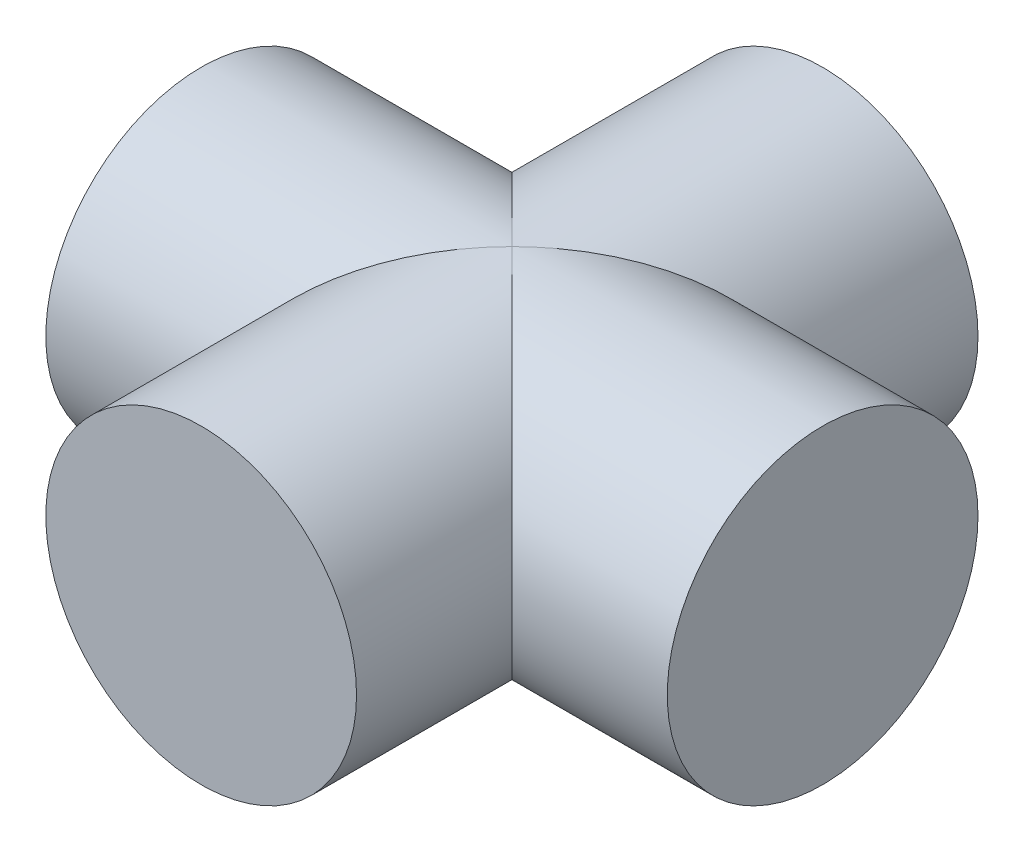
from build123d import *

# Parameters (mm, degrees)
EXTRUDE_1_DEPTH      = 10
EXTRUDE_1_DEPTH_BACK = 10
SKETCH_1_R           = 5
EXTRUDE_2_DEPTH      = 10
EXTRUDE_2_DEPTH_BACK = 10
SKETCH_2_R           = 5


with BuildPart() as part:
    # 草图1 → 凸台-拉伸1 (new, two sides: drawn at the far end of the back side and taken through both)
    with BuildSketch(Plane.XY.offset(-EXTRUDE_1_DEPTH_BACK)):
        Circle(SKETCH_1_R)
    extrude(amount=EXTRUDE_1_DEPTH + EXTRUDE_1_DEPTH_BACK)

    # 草图2 → 凸台-拉伸2 (add, two sides: drawn at the far end of the back side and taken through both)
    with BuildSketch(Plane(origin=(0, 0, 0), x_dir=(0, 0, -1), z_dir=(1, 0, 0)).offset(-EXTRUDE_2_DEPTH_BACK)):
        Circle(SKETCH_2_R)
    extrude(amount=EXTRUDE_2_DEPTH + EXTRUDE_2_DEPTH_BACK)


solid = part.part
